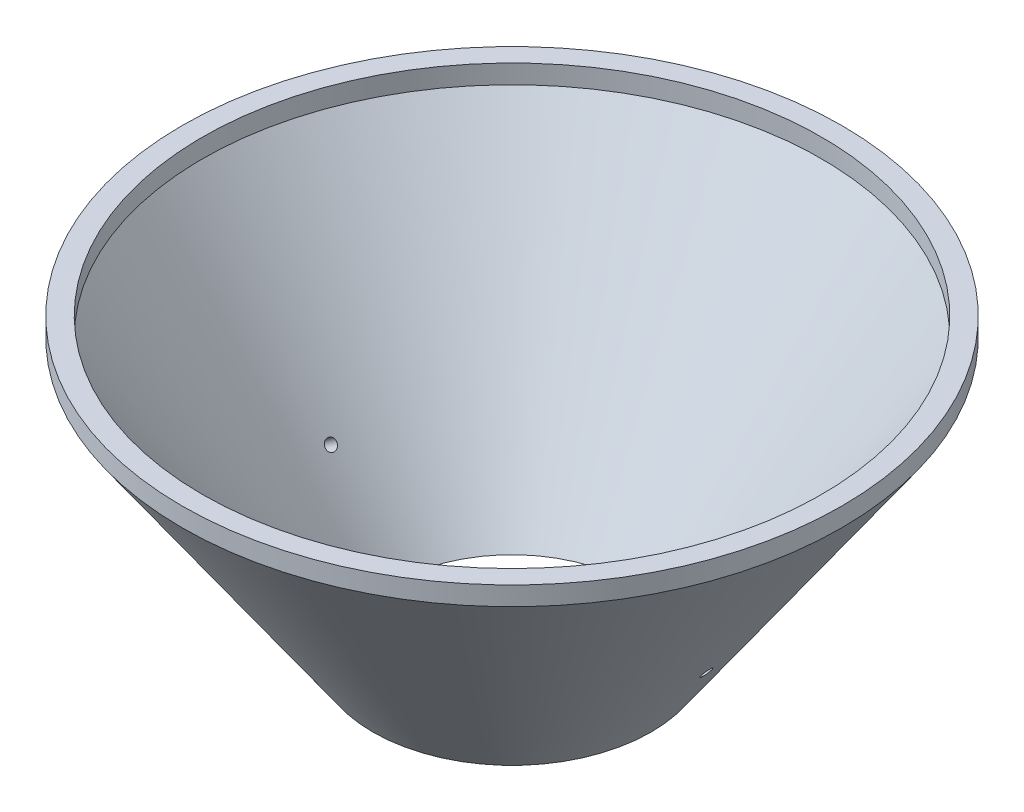
from build123d import *

# Parameters (mm, degrees)
SKETCH36_R          = 0.6
SIDE_HOLES_DEPTH    = 2
CIRPATTERN2_COUNT   = 2
SKETCH37_R          = 35
SKETCH37_R_2        = 32.86364447
BOSS_EXTRUDE1_DEPTH = 2


with BuildPart() as part:
    # Sketch35 → Revolve1 (revolve)
    with BuildSketch(Plane.XY, mode=Mode.PRIVATE) as revolve1_sk:
        Polygon((32.86364447, 28.896639018), (12.63, 0), (14.76635553, 0), (35, 28.896639018), align=None)
    revolve(revolve1_sk.sketch.rotate(Axis((0, 28.896639018, 0), (0, -1, 0)), 90), axis=Axis((0, 28.896639018, 0), (0, -1, 0)))

    # Sketch36 → side-holes (cut, symmetric)
    with BuildSketch(Plane(origin=(8.474857205, -5.9341589, 0), x_dir=(0, 0, 1), z_dir=(-0.8191520442889934, 0.5735764363510439, 0))):
        with Locations(Location((0, 18.744270391, 0), (0, 0, 235.340174101))):
            Circle(SKETCH36_R)
    side_holes = extrude(amount=SIDE_HOLES_DEPTH, both=True, mode=Mode.SUBTRACT)

    # CirPattern2: side-holes ×2 about axis
    cirpattern2_axis = Axis((0, 0, 0), (0, 1, 0))
    for i in range(1, CIRPATTERN2_COUNT):
        add(side_holes.rotate(cirpattern2_axis, i * 360 / CIRPATTERN2_COUNT), mode=Mode.SUBTRACT)

    # Sketch37 → Boss-Extrude1 (add)
    with BuildSketch(Plane(origin=(0, 28.896639018, 0), x_dir=(1, 0, 0), z_dir=(0, 1, 0))):
        with Locations(Location((0, 0, 0), (0, 0, 270))):
            Circle(SKETCH37_R)
        with Locations(Location((0, 0, 0), (0, 0, 270))):
            Circle(SKETCH37_R_2, mode=Mode.SUBTRACT)
    extrude(amount=BOSS_EXTRUDE1_DEPTH)


solid = part.part
